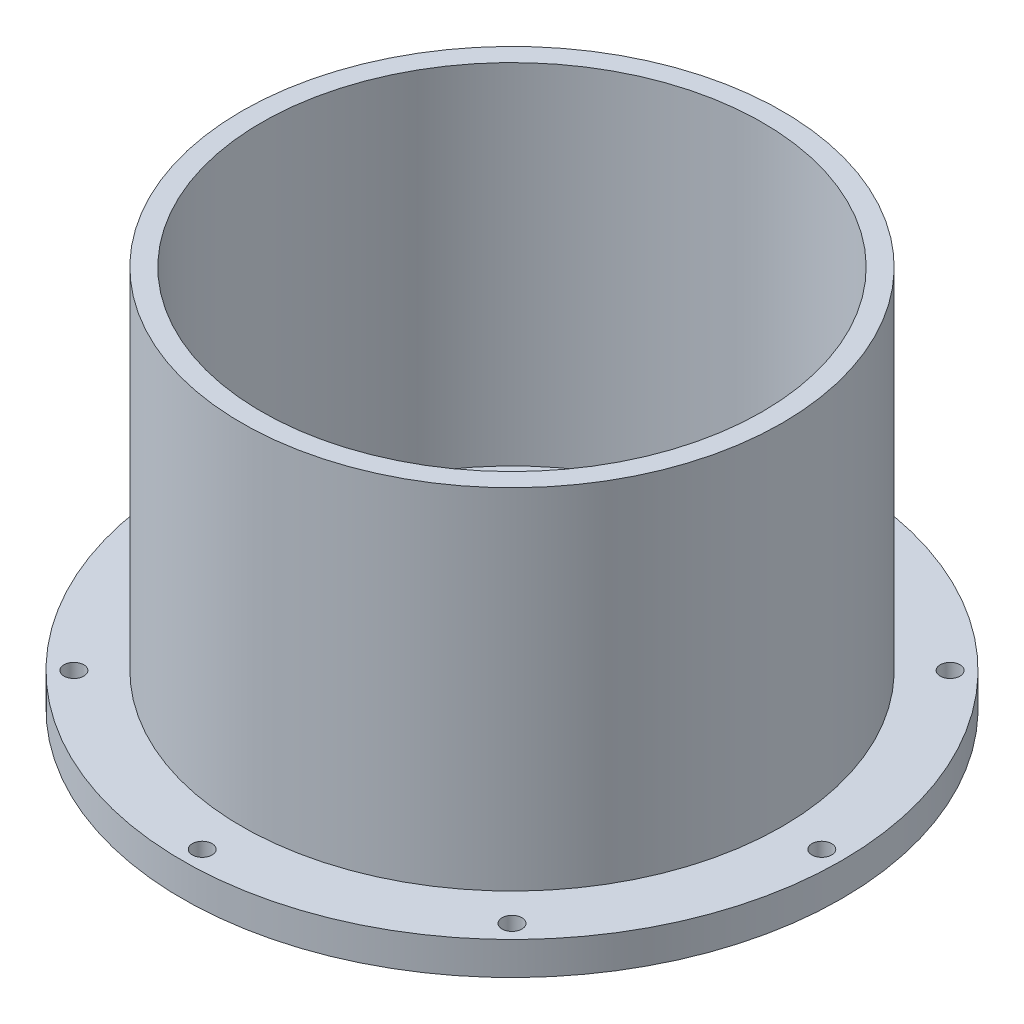
from build123d import *

# Parameters (mm, degrees)
SKETCH3_R          = 1.5
CUT_EXTRUDE1_DEPTH = 89.36854644


with BuildPart() as part:
    # Sketch2 → Revolve1 (revolve)
    with BuildSketch(Plane.XY):
        Polygon((0, 5), (0, 0), (50, 0), (50, 5), (41, 5), (41, 58), (38, 58), (38, 5), align=None)
    revolve(axis=Axis((0, 0, 0), (0, 1, 0)))

    # Sketch3 → Cut-Extrude1 (cut, through all)
    with BuildSketch(Plane(origin=(0, 5, 0), x_dir=(1, 0, 0), z_dir=(0, 1, 0))):
        with Locations(Location((-13.5, 4, 0), (0, 0, 180))):
            Circle(SKETCH3_R)
        with Locations(Location((13.5, 4, 0), (0, 0, 180))):
            Circle(SKETCH3_R)
        with Locations(Location((-13.5, -4, 0), (0, 0, 180))):
            Circle(SKETCH3_R)
        with Locations(Location((-13.5, -12, 0), (0, 0, 180))):
            Circle(SKETCH3_R)
        with Locations(Location((13.5, -4, 0), (0, 0, 180))):
            Circle(SKETCH3_R)
        with Locations(Location((13.5, -12, 0), (0, 0, 180))):
            Circle(SKETCH3_R)
        with Locations(Location((-13.5, 12, 0), (0, 0, 180))):
            Circle(SKETCH3_R)
        with Locations(Location((13.5, 12, 0), (0, 0, 180))):
            Circle(SKETCH3_R)
        with Locations(Location((0, -47, 0), (0, 0, 180))):
            Circle(SKETCH3_R)
        with Locations(Location((-33.234018716, -33.234018716, 0), (0, 0, 180))):
            Circle(SKETCH3_R)
        with Locations(Location((-47, 0, 0), (0, 0, 180))):
            Circle(SKETCH3_R)
        with Locations(Location((-33.234018716, 33.234018716, 0), (0, 0, 180))):
            Circle(SKETCH3_R)
        with Locations(Location((0, 47, 0), (0, 0, 180))):
            Circle(SKETCH3_R)
        with Locations(Location((33.234018716, 33.234018716, 0), (0, 0, 180))):
            Circle(SKETCH3_R)
        with Locations(Location((47, 0, 0), (0, 0, 180))):
            Circle(SKETCH3_R)
        with Locations(Location((33.234018716, -33.234018716, 0), (0, 0, 180))):
            Circle(SKETCH3_R)
    extrude(amount=-CUT_EXTRUDE1_DEPTH, mode=Mode.SUBTRACT)


solid = part.part
